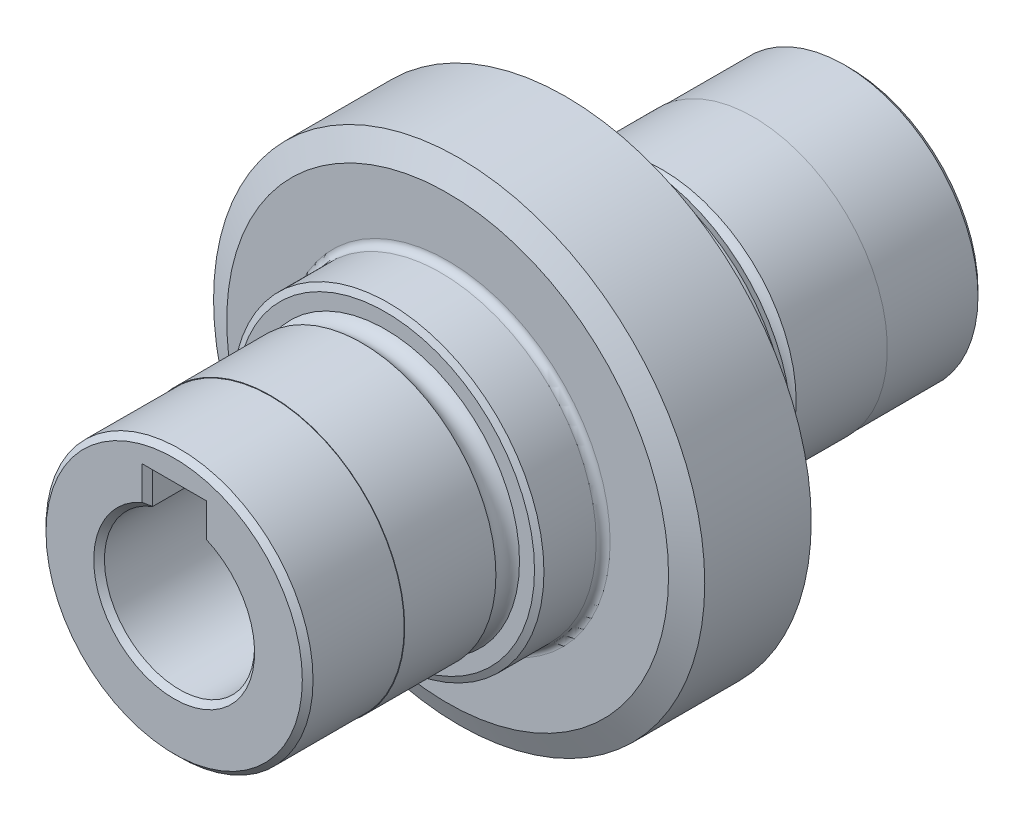
from build123d import *

# Parameters (mm, degrees)
SKICA1_R                    = 22.9
P_IDAT_VYSUNUT_M1_DEPTH     = 31.5
SKICA2_R                    = 7
ODEBRAT_VYSUNUT_M1_DEPTH    = 71.836572475
SKICA3_W                    = 5
SKICA3_H                    = 4
ODEBRAT_VYSUNUT_M2_DEPTH    = 71.836572475
ODEBRAT_START               = -25.5
SKICA5_R                    = 22.9
SKICA5_R_2                  = 14.5
ODEBRAT_VYSUNUT_M4_DEPTH    = 25.5
ODEBRAT_START_2             = -19.7
SKICA6_R                    = 14.5
SKICA6_R_2                  = 12.5
ODEBRAT_VYSUNUT_M5_DEPTH    = 19.7
ODEBRAT_START_3             = -9
SKICA7_R                    = 12.5
SKICA7_R_2                  = 12.45
ODEBRAT_VYSUNUT_M6_DEPTH    = 9
ZKOSEN_4_SIZE               = 0.6
ZKOSEN_4_SIZE2              = 0.279784595
ZKOSEN_4_OF_ZRCADLIT2_SIZE2 = 0.6
ZKOSEN_4_OF_ZRCADLIT2_SIZE  = 0.279784595
ZKOSEN_1_SIZE               = 0.5
ZAOBLIT1_R                  = 0.65
ZKOSEN_2_SIZE               = 1
ZKOSEN_2_SIZE2              = 2.299842547
ZKOSEN_3_SIZE               = 2.3
ZKOSEN_3_SIZE2              = 1.072507614


with BuildPart() as part:
    # Skica1 → Přidat vysunutím1 (new, symmetric)
    with BuildSketch(Plane.XY):
        Circle(SKICA1_R)
    extrude(amount=P_IDAT_VYSUNUT_M1_DEPTH, both=True)

    # Skica2 → Odebrat vysunutím1 (cut, through all)
    with BuildSketch(Plane.XY.offset(31.5)):
        Circle(SKICA2_R)
    extrude(amount=-ODEBRAT_VYSUNUT_M1_DEPTH, mode=Mode.SUBTRACT)

    # Skica3 → Odebrat vysunutím2 (cut, through all)
    with BuildSketch(Plane.XY.offset(31.5)):
        with Locations((0, 7.5)):
            Rectangle(SKICA3_W, SKICA3_H)
    extrude(amount=-ODEBRAT_VYSUNUT_M2_DEPTH, mode=Mode.SUBTRACT)

    # Skica5 → Odebrat vysunutím4 (cut)
    with BuildSketch(Plane(origin=(0, 0, -31.5), x_dir=(-1, 0, 0), z_dir=(0, 0, -1)).offset(ODEBRAT_START)):
        Circle(SKICA5_R)
        Circle(SKICA5_R_2, mode=Mode.SUBTRACT)
    odebrat_vysunut_m4 = extrude(amount=ODEBRAT_VYSUNUT_M4_DEPTH, mode=Mode.SUBTRACT)

    # Skica6 → Odebrat vysunutím5 (cut)
    with BuildSketch(Plane(origin=(0, 0, -31.5), x_dir=(-1, 0, 0), z_dir=(0, 0, -1)).offset(ODEBRAT_START_2)):
        Circle(SKICA6_R)
        Circle(SKICA6_R_2, mode=Mode.SUBTRACT)
    odebrat_vysunut_m5 = extrude(amount=ODEBRAT_VYSUNUT_M5_DEPTH, mode=Mode.SUBTRACT)

    # Skica7 → Odebrat vysunutím6 (cut)
    with BuildSketch(Plane(origin=(0, 0, -31.5), x_dir=(-1, 0, 0), z_dir=(0, 0, -1)).offset(ODEBRAT_START_3)):
        Circle(SKICA7_R)
        Circle(SKICA7_R_2, mode=Mode.SUBTRACT)
    odebrat_vysunut_m6 = extrude(amount=ODEBRAT_VYSUNUT_M6_DEPTH, mode=Mode.SUBTRACT)

    # Zkosení4
    zkosen_4_edges = [part.edges().sort_by_distance(p)[0] for p in [
        (14.5, 0, -11.8),
    ]]
    zkosen_4_side = [part.faces().sort_by_distance(p)[0] for p in [
        (14.5, 0, -8.9),
    ]]
    chamfer(zkosen_4_edges, length=ZKOSEN_4_SIZE, length2=ZKOSEN_4_SIZE2, reference=zkosen_4_side[0])

    # Skica8 → Odebrat rotací1 (revolve, cut)
    with BuildSketch(Plane(origin=(0, 0, 0), x_dir=(0, 0, -1), z_dir=(1, 0, 0)), mode=Mode.PRIVATE) as odebrat_rotac_1_sk:
        with BuildLine():
            Line((11.8, -12.5), (14, -12.5))
            ThreePointArc((14, -12.5), (12.9, -11.892820323), (11.8, -12.5))
        make_face()
    odebrat_rotac_1 = revolve(odebrat_rotac_1_sk.sketch.rotate(Axis((0, 0, 0), (0, 0, -1)), 90), axis=Axis((0, 0, 0), (0, 0, -1)), mode=Mode.SUBTRACT)

    # Zrcadlit2: Odebrat vysunutím4, Odebrat vysunutím5, Odebrat vysunutím6, Odebrat rotací1 across plane
    add(odebrat_vysunut_m4.mirror(Plane.XY), mode=Mode.SUBTRACT)
    add(odebrat_vysunut_m5.mirror(Plane.XY), mode=Mode.SUBTRACT)
    add(odebrat_vysunut_m6.mirror(Plane.XY), mode=Mode.SUBTRACT)
    add(odebrat_rotac_1.mirror(Plane.XY), mode=Mode.SUBTRACT)

    # Zkosení4 of Zrcadlit2
    zkosen_4_of_zrcadlit2_edges = [part.edges().sort_by_distance(p)[0] for p in [
        (14.5, 0, 11.8),
    ]]
    chamfer(zkosen_4_of_zrcadlit2_edges, length=ZKOSEN_4_OF_ZRCADLIT2_SIZE, length2=ZKOSEN_4_OF_ZRCADLIT2_SIZE2)

    # Zkosení1
    zkosen_1_edges = [part.edges().sort_by_distance(p)[0] for p in [
        (0, -7, -31.5),
        (0, -7, 31.5),
        (2.5, 8.019174208, -31.5),
        (-2.5, 8.019174208, -31.5),
        (-2.5, 8.019174208, 31.5),
        (2.5, 8.019174208, 31.5),
        (0, 9.5, 31.5),
        (0, 9.5, -31.5),
        (12.45, 0, -31.5),
        (12.45, 0, 31.5),
    ]]
    chamfer(zkosen_1_edges, length=ZKOSEN_1_SIZE)

    # Zaoblit1
    zaoblit1_edges = [part.edges().sort_by_distance(p)[0] for p in [
        (14.5, 0, -6),
        (14.5, 0, 6),
    ]]
    fillet(zaoblit1_edges, radius=ZAOBLIT1_R)

    # Zkosení2
    zkosen_2_edges = [part.edges().sort_by_distance(p)[0] for p in [
        (-22.9, 0, -6),
    ]]
    zkosen_2_side = [part.faces().sort_by_distance(p)[0] for p in [
        (-22.9, 0, 0),
    ]]
    chamfer(zkosen_2_edges, length=ZKOSEN_2_SIZE, length2=ZKOSEN_2_SIZE2, reference=zkosen_2_side[0])

    # Zkosení3
    zkosen_3_edges = [part.edges().sort_by_distance(p)[0] for p in [
        (-22.9, 0, 6),
    ]]
    zkosen_3_side = [part.faces().sort_by_distance(p)[0] for p in [
        (15.797709812, 0, 6),
    ]]
    chamfer(zkosen_3_edges, length=ZKOSEN_3_SIZE, length2=ZKOSEN_3_SIZE2, reference=zkosen_3_side[0])


solid = part.part
